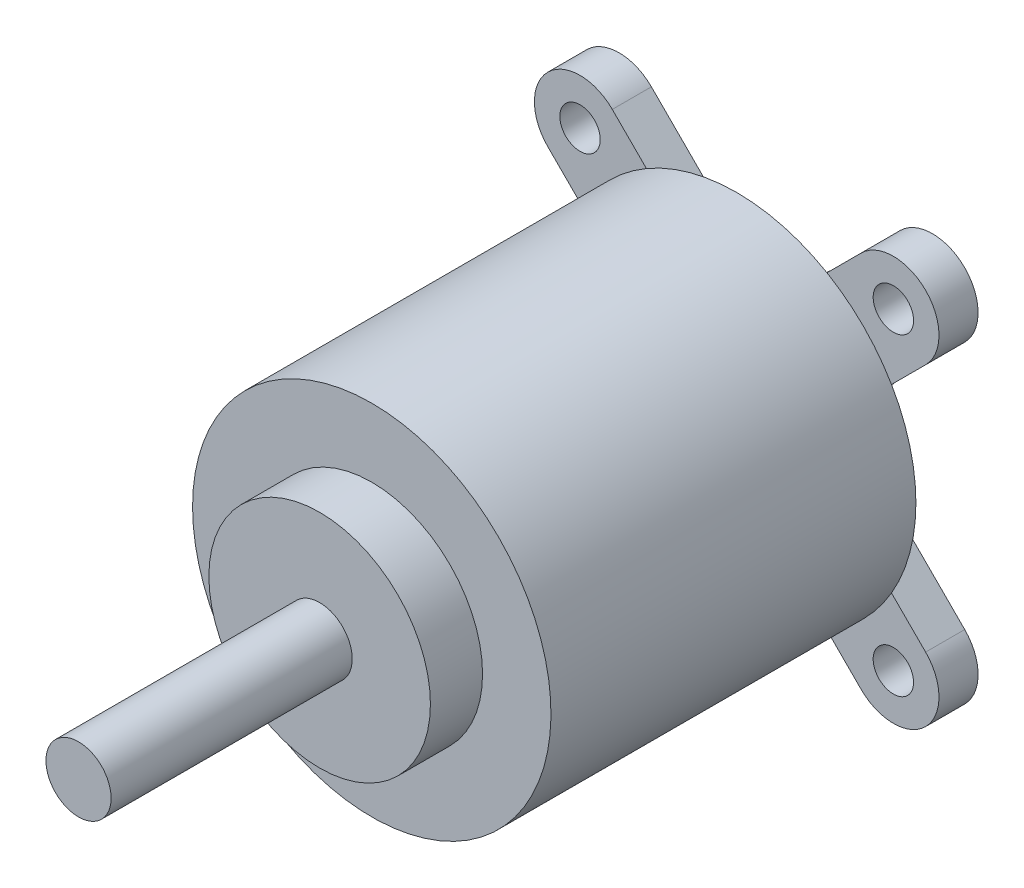
from build123d import *

# Parameters (mm, degrees)
SKETCH1_R             = 13.75
BOSS_EXTRUDE1_DEPTH   = 28
SKETCH2_R             = 8.5
BOSS_EXTRUDE2_DEPTH   = 4
BOSS_EXTRUDE3_DEPTH   = 3
SKETCH5_R             = 1.55
CUT_EXTRUDE1_DEPTH    = 3
BODY_MOVE_COPY1_ANGLE = 45
SKETCH6_R             = 2.5
BOSS_EXTRUDE4_DEPTH   = 18.5


with BuildPart() as part:
    # Sketch1 → Boss-Extrude1 (new body)
    with BuildSketch(Plane.XY):
        Circle(SKETCH1_R)
    extrude(amount=BOSS_EXTRUDE1_DEPTH)

    # Sketch2 → Boss-Extrude2 (add)
    with BuildSketch(Plane.XY.offset(28)):
        Circle(SKETCH2_R)
    extrude(amount=BOSS_EXTRUDE2_DEPTH)

    # Sketch4 → Boss-Extrude3 (add)
    with BuildSketch(Plane(origin=(0, 0, 0), x_dir=(-1, 0, 0), z_dir=(0, 0, -1))):
        with BuildLine():
            Line((-3.5, -17.000000602), (-3.5, -9.5))
            ThreePointArc((-3.5, -9.5), (-5.257359313, -5.257359313), (-9.5, -3.5))
            Line((-9.5, -3.5), (-17, -3.5))
            ThreePointArc((-17, -3.5), (-20.5, 0), (-17, 3.5))
            Line((-17, 3.5), (-9.5, 3.5))
            ThreePointArc((-9.5, 3.5), (-5.257359313, 5.257359313), (-3.5, 9.5))
            Line((-3.5, 9.5), (-3.5, 17.000000602))
            ThreePointArc((-3.5, 17.000000602), (0, 20.5), (3.5, 17.000000602))
            Line((3.5, 17.000000602), (3.5, 9.5))
            ThreePointArc((3.5, 9.5), (5.257359313, 5.257359313), (9.5, 3.5))
            Line((9.5, 3.5), (17, 3.5))
            ThreePointArc((17, 3.5), (20.5, 0), (17, -3.5))
            Line((17, -3.5), (9.5, -3.5))
            ThreePointArc((9.5, -3.5), (5.257359313, -5.257359313), (3.5, -9.5))
            Line((3.5, -9.5), (3.5, -17.000000602))
            ThreePointArc((3.5, -17.000000602), (0, -20.5), (-3.5, -17.000000602))
        make_face()
    extrude(amount=BOSS_EXTRUDE3_DEPTH)

    # Sketch5 → Cut-Extrude1 (cut)
    with BuildSketch(Plane(origin=(0, 0, -3), x_dir=(-1, 0, 0), z_dir=(0, 0, -1))):
        with Locations((0, 17)):
            Circle(SKETCH5_R)
        with Locations((17, 0)):
            Circle(SKETCH5_R)
        with Locations((0, -17)):
            Circle(SKETCH5_R)
        with Locations((-17, 0)):
            Circle(SKETCH5_R)
    extrude(amount=-CUT_EXTRUDE1_DEPTH, mode=Mode.SUBTRACT)


with BuildPart() as part_1:
    # Body-Move/Copy1: moved
    add(part.part.rotate(Axis((0, 0, 0), (0, 0, 1)), BODY_MOVE_COPY1_ANGLE))

    # Sketch6 → Boss-Extrude4 (add)
    with BuildSketch(Plane.XY.offset(32)):
        Circle(SKETCH6_R)
    extrude(amount=BOSS_EXTRUDE4_DEPTH)


solid = part_1.part
